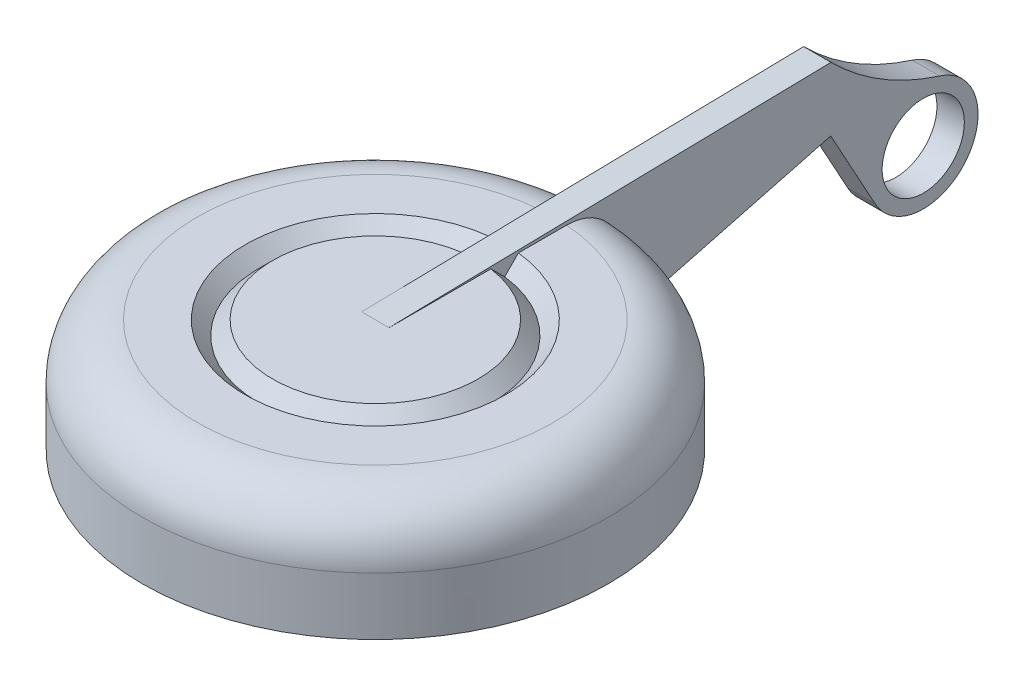
from build123d import *

# Parameters (mm, degrees)
FILLET1_R                = 2
SKETCH5_R                = 8.5
SKETCH5_R_2              = 7
BOSS_EXTRUDE1_DEPTH      = 0.1
BOSS_EXTRUDE2_DEPTH      = 0.5
BOSS_EXTRUDE2_DEPTH_BACK = 0.5
SKETCH6_R                = 1.5


with BuildPart() as part:
    # Sketch4 → Revolve1 (revolve)
    with BuildSketch(Plane(origin=(0, 0, 0), x_dir=(0, 0, -1), z_dir=(1, 0, 0))):
        Polygon((0, 0), (-3.75, 0), (-4.25, -0.5), (-4.75, 0), (-8.5, 0), (-8.5, -4), (0, -4), align=None)
    revolve(axis=Axis((0, 1.890471386, 0), (0, -1, 0)))

    # Fillet1
    fillet1_edges = [part.edges().sort_by_distance(p)[0] for p in [
        (0, 0, -8.5),
    ]]
    fillet(fillet1_edges, radius=FILLET1_R)



with BuildPart() as body_2:
    # Sketch5 → Boss-Extrude1 (new body)
    with BuildSketch(Plane.XZ.offset(4)):
        Circle(SKETCH5_R)
        Circle(SKETCH5_R_2, mode=Mode.SUBTRACT)
    extrude(amount=BOSS_EXTRUDE1_DEPTH)


with BuildPart() as part_1:
    add(part.part)

    add(body_2.part)  # Boss-Extrude2 merges body 2
    # Sketch6 → Boss-Extrude2 (add, two sides: drawn at the far end of the back side and taken through both)
    with BuildSketch(Plane(origin=(0, 0, 0), x_dir=(0, 0, -1), z_dir=(1, 0, 0)).offset(-BOSS_EXTRUDE2_DEPTH_BACK)):
        with BuildLine():
            Line((16.132863069, 0.320027848), (0, 0))
            Line((0, 0), (0, -0.907670556))
            Line((0, -0.907670556), (7.174444166, -0.907670556))
            Line((7.174444166, -0.907670556), (8.5, -4))
            Line((8.5, -4), (16.12184584, -1.999779955))
            Line((16.12184584, -1.999779955), (17.746442499, -4.961787965))
            ThreePointArc((17.746442499, -4.961787965), (21.046890478, -5.267726252), (20.098589091, -2.09167846))
            ThreePointArc((20.098589091, -2.09167846), (17.968839585, -1.127360353), (16.132863069, 0.320027848))
        make_face()
        with Locations((19.5, -4)):
            Circle(SKETCH6_R, mode=Mode.SUBTRACT)
    extrude(amount=BOSS_EXTRUDE2_DEPTH + BOSS_EXTRUDE2_DEPTH_BACK)


solid = part_1.part
